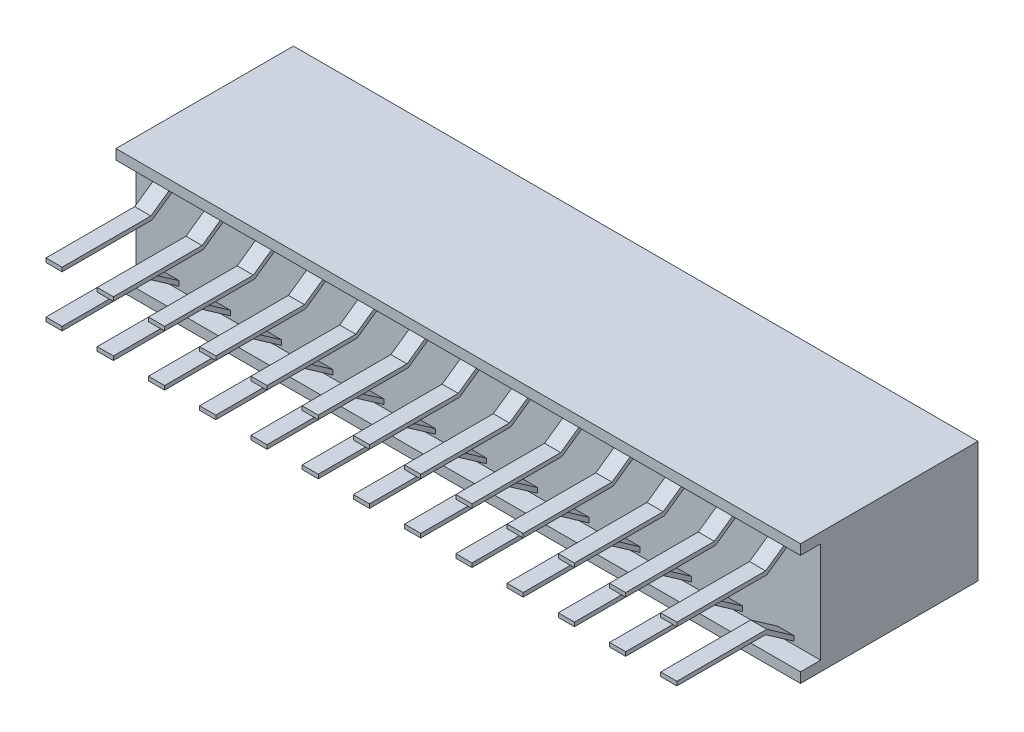
from build123d import *

# Parameters (mm, degrees)
SKETCH1_W                  = 16.97
SKETCH1_H                  = 3
BOSS_EXTRUDE1_DEPTH        = 4.4
SKETCH3_W                  = 0.45
SKETCH3_H                  = 0.45
CUT_EXTRUDE1_DEPTH         = 3
CHAMFER1_SIZE              = 0.1
SKETCH4_W                  = 0.5
SKETCH4_H                  = 2.5
CUT_EXTRUDE2_DEPTH         = 18.595195367
BOSS_EXTRUDE2_DEPTH        = 0.2
LPATTERN1_COUNT            = 13
LPATTERN1_PITCH            = 1.27
LPATTERN1_COPY_1_DEPTH     = 0.2
LPATTERN1_COPY_2_DEPTH     = 0.2
LPATTERN1_COPY_3_DEPTH     = 0.2
LPATTERN1_COPY_4_DEPTH     = 0.2
LPATTERN1_COPY_5_DEPTH     = 0.2
LPATTERN1_COPY_6_DEPTH     = 0.2
LPATTERN1_COPY_7_DEPTH     = 0.2
LPATTERN1_COPY_8_DEPTH     = 0.2
LPATTERN1_COPY_9_DEPTH     = 0.2
LPATTERN1_COPY_10_DEPTH    = 0.2
LPATTERN1_COPY_11_DEPTH    = 0.2
LPATTERN1_COPY_12_DEPTH    = 0.2
CHAMFER1_OF_LPATTERN1_SIZE = 0.1


with BuildPart() as part:
    # Sketch1 → Boss-Extrude1 (new body)
    with BuildSketch(Plane.XY):
        Rectangle(SKETCH1_W, SKETCH1_H)
    extrude(amount=BOSS_EXTRUDE1_DEPTH)

    # Sketch3 → Cut-Extrude1 (cut)
    with BuildSketch(Plane(origin=(0, 0, 0), x_dir=(-1, 0, 0), z_dir=(0, 0, -1))):
        with Locations((-7.62, 0.635)):
            Rectangle(SKETCH3_W, SKETCH3_H)
        with Locations((-7.62, -0.635)):
            Rectangle(SKETCH3_W, SKETCH3_H)
    cut_extrude1 = extrude(amount=-CUT_EXTRUDE1_DEPTH, mode=Mode.SUBTRACT)

    # Chamfer1
    chamfer1_edges = [part.edges().sort_by_distance(p)[0] for p in [
        (7.395, 0.635, 0),
        (7.62, 0.86, 0),
        (7.845, 0.635, 0),
        (7.62, 0.41, 0),
        (7.395, -0.635, 0),
        (7.62, -0.41, 0),
        (7.845, -0.635, 0),
        (7.62, -0.86, 0),
    ]]
    chamfer(chamfer1_edges, length=CHAMFER1_SIZE)

    # Sketch4 → Cut-Extrude2 (cut, through all)
    with BuildSketch(Plane(origin=(8.485, 0, 0), x_dir=(0, 0, -1), z_dir=(1, 0, 0))):
        with Locations((-4.15, 0)):
            Rectangle(SKETCH4_W, SKETCH4_H)
    extrude(amount=-CUT_EXTRUDE2_DEPTH, mode=Mode.SUBTRACT)

    # Sketch5 → Boss-Extrude2 (add, symmetric)
    with BuildSketch(Plane(origin=(7.62, 0, 0), x_dir=(0, 0, -1), z_dir=(1, 0, 0))):
        Polygon((-3.9, 1.175145277), (-4.6, 0.685), (-6.8, 0.685), (-6.8, 0.585), (-4.568470121, 0.585), (-3.9, 1.053067818), align=None)
    boss_extrude2 = extrude(amount=BOSS_EXTRUDE2_DEPTH, both=True)

    # Mirror1: Boss-Extrude2 across plane
    add(boss_extrude2.mirror(Plane.ZX))

    # LPattern1: Cut-Extrude1, Boss-Extrude2 ×13
    with Locations(*[(-i * LPATTERN1_PITCH, 0, 0) for i in range(1, LPATTERN1_COUNT)]):
        add(cut_extrude1, mode=Mode.SUBTRACT)
        add(boss_extrude2)

    # LPattern1 copy 1 sketch → LPattern1 copy 1 (add, symmetric)
    with BuildSketch(Plane(origin=(6.35, 0, 0), x_dir=(0, 0, -1), z_dir=(1, 0, 0))):
        Polygon((-3.9, -1.175145277), (-4.6, -0.685), (-6.8, -0.685), (-6.8, -0.585), (-4.568470121, -0.585), (-3.9, -1.053067818), align=None)
    extrude(amount=LPATTERN1_COPY_1_DEPTH, both=True)

    # LPattern1 copy 2 sketch → LPattern1 copy 2 (add, symmetric)
    with BuildSketch(Plane(origin=(5.08, 0, 0), x_dir=(0, 0, -1), z_dir=(1, 0, 0))):
        Polygon((-3.9, -1.175145277), (-4.6, -0.685), (-6.8, -0.685), (-6.8, -0.585), (-4.568470121, -0.585), (-3.9, -1.053067818), align=None)
    extrude(amount=LPATTERN1_COPY_2_DEPTH, both=True)

    # LPattern1 copy 3 sketch → LPattern1 copy 3 (add, symmetric)
    with BuildSketch(Plane(origin=(3.81, 0, 0), x_dir=(0, 0, -1), z_dir=(1, 0, 0))):
        Polygon((-3.9, -1.175145277), (-4.6, -0.685), (-6.8, -0.685), (-6.8, -0.585), (-4.568470121, -0.585), (-3.9, -1.053067818), align=None)
    extrude(amount=LPATTERN1_COPY_3_DEPTH, both=True)

    # LPattern1 copy 4 sketch → LPattern1 copy 4 (add, symmetric)
    with BuildSketch(Plane(origin=(2.54, 0, 0), x_dir=(0, 0, -1), z_dir=(1, 0, 0))):
        Polygon((-3.9, -1.175145277), (-4.6, -0.685), (-6.8, -0.685), (-6.8, -0.585), (-4.568470121, -0.585), (-3.9, -1.053067818), align=None)
    extrude(amount=LPATTERN1_COPY_4_DEPTH, both=True)

    # LPattern1 copy 5 sketch → LPattern1 copy 5 (add, symmetric)
    with BuildSketch(Plane(origin=(1.27, 0, 0), x_dir=(0, 0, -1), z_dir=(1, 0, 0))):
        Polygon((-3.9, -1.175145277), (-4.6, -0.685), (-6.8, -0.685), (-6.8, -0.585), (-4.568470121, -0.585), (-3.9, -1.053067818), align=None)
    extrude(amount=LPATTERN1_COPY_5_DEPTH, both=True)

    # LPattern1 copy 6 sketch → LPattern1 copy 6 (add, symmetric)
    with BuildSketch(Plane(origin=(0, 0, 0), x_dir=(0, 0, -1), z_dir=(1, 0, 0))):
        Polygon((-3.9, -1.175145277), (-4.6, -0.685), (-6.8, -0.685), (-6.8, -0.585), (-4.568470121, -0.585), (-3.9, -1.053067818), align=None)
    extrude(amount=LPATTERN1_COPY_6_DEPTH, both=True)

    # LPattern1 copy 7 sketch → LPattern1 copy 7 (add, symmetric)
    with BuildSketch(Plane(origin=(-1.27, 0, 0), x_dir=(0, 0, -1), z_dir=(1, 0, 0))):
        Polygon((-3.9, -1.175145277), (-4.6, -0.685), (-6.8, -0.685), (-6.8, -0.585), (-4.568470121, -0.585), (-3.9, -1.053067818), align=None)
    extrude(amount=LPATTERN1_COPY_7_DEPTH, both=True)

    # LPattern1 copy 8 sketch → LPattern1 copy 8 (add, symmetric)
    with BuildSketch(Plane(origin=(-2.54, 0, 0), x_dir=(0, 0, -1), z_dir=(1, 0, 0))):
        Polygon((-3.9, -1.175145277), (-4.6, -0.685), (-6.8, -0.685), (-6.8, -0.585), (-4.568470121, -0.585), (-3.9, -1.053067818), align=None)
    extrude(amount=LPATTERN1_COPY_8_DEPTH, both=True)

    # LPattern1 copy 9 sketch → LPattern1 copy 9 (add, symmetric)
    with BuildSketch(Plane(origin=(-3.81, 0, 0), x_dir=(0, 0, -1), z_dir=(1, 0, 0))):
        Polygon((-3.9, -1.175145277), (-4.6, -0.685), (-6.8, -0.685), (-6.8, -0.585), (-4.568470121, -0.585), (-3.9, -1.053067818), align=None)
    extrude(amount=LPATTERN1_COPY_9_DEPTH, both=True)

    # LPattern1 copy 10 sketch → LPattern1 copy 10 (add, symmetric)
    with BuildSketch(Plane(origin=(-5.08, 0, 0), x_dir=(0, 0, -1), z_dir=(1, 0, 0))):
        Polygon((-3.9, -1.175145277), (-4.6, -0.685), (-6.8, -0.685), (-6.8, -0.585), (-4.568470121, -0.585), (-3.9, -1.053067818), align=None)
    extrude(amount=LPATTERN1_COPY_10_DEPTH, both=True)

    # LPattern1 copy 11 sketch → LPattern1 copy 11 (add, symmetric)
    with BuildSketch(Plane(origin=(-6.35, 0, 0), x_dir=(0, 0, -1), z_dir=(1, 0, 0))):
        Polygon((-3.9, -1.175145277), (-4.6, -0.685), (-6.8, -0.685), (-6.8, -0.585), (-4.568470121, -0.585), (-3.9, -1.053067818), align=None)
    extrude(amount=LPATTERN1_COPY_11_DEPTH, both=True)

    # LPattern1 copy 12 sketch → LPattern1 copy 12 (add, symmetric)
    with BuildSketch(Plane(origin=(-7.62, 0, 0), x_dir=(0, 0, -1), z_dir=(1, 0, 0))):
        Polygon((-3.9, -1.175145277), (-4.6, -0.685), (-6.8, -0.685), (-6.8, -0.585), (-4.568470121, -0.585), (-3.9, -1.053067818), align=None)
    extrude(amount=LPATTERN1_COPY_12_DEPTH, both=True)

    # Chamfer1 of LPattern1
    chamfer1_of_lpattern1_edges = [part.edges().sort_by_distance(p)[0] for p in [
        (6.125, 0.635, 0),
        (6.35, 0.86, 0),
        (6.575, 0.635, 0),
        (6.35, 0.41, 0),
        (6.125, -0.635, 0),
        (6.35, -0.41, 0),
        (6.575, -0.635, 0),
        (6.35, -0.86, 0),
        (4.855, 0.635, 0),
        (5.08, 0.86, 0),
        (5.305, 0.635, 0),
        (5.08, 0.41, 0),
        (4.855, -0.635, 0),
        (5.08, -0.41, 0),
        (5.305, -0.635, 0),
        (5.08, -0.86, 0),
        (3.585, 0.635, 0),
        (3.81, 0.86, 0),
        (4.035, 0.635, 0),
        (3.81, 0.41, 0),
        (3.585, -0.635, 0),
        (3.81, -0.41, 0),
        (4.035, -0.635, 0),
        (3.81, -0.86, 0),
        (2.315, 0.635, 0),
        (2.54, 0.86, 0),
        (2.765, 0.635, 0),
        (2.54, 0.41, 0),
        (2.315, -0.635, 0),
        (2.54, -0.41, 0),
        (2.765, -0.635, 0),
        (2.54, -0.86, 0),
        (1.045, 0.635, 0),
        (1.27, 0.86, 0),
        (1.495, 0.635, 0),
        (1.27, 0.41, 0),
        (1.045, -0.635, 0),
        (1.27, -0.41, 0),
        (1.495, -0.635, 0),
        (1.27, -0.86, 0),
        (-0.225, 0.635, 0),
        (0, 0.86, 0),
        (0.225, 0.635, 0),
        (0, 0.41, 0),
        (-0.225, -0.635, 0),
        (0, -0.41, 0),
        (0.225, -0.635, 0),
        (0, -0.86, 0),
        (-1.495, 0.635, 0),
        (-1.27, 0.86, 0),
        (-1.045, 0.635, 0),
        (-1.27, 0.41, 0),
        (-1.495, -0.635, 0),
        (-1.27, -0.41, 0),
        (-1.045, -0.635, 0),
        (-1.27, -0.86, 0),
        (-2.765, 0.635, 0),
        (-2.54, 0.86, 0),
        (-2.315, 0.635, 0),
        (-2.54, 0.41, 0),
        (-2.765, -0.635, 0),
        (-2.54, -0.41, 0),
        (-2.315, -0.635, 0),
        (-2.54, -0.86, 0),
        (-4.035, 0.635, 0),
        (-3.81, 0.86, 0),
        (-3.585, 0.635, 0),
        (-3.81, 0.41, 0),
        (-4.035, -0.635, 0),
        (-3.81, -0.41, 0),
        (-3.585, -0.635, 0),
        (-3.81, -0.86, 0),
        (-5.305, 0.635, 0),
        (-5.08, 0.86, 0),
        (-4.855, 0.635, 0),
        (-5.08, 0.41, 0),
        (-5.305, -0.635, 0),
        (-5.08, -0.41, 0),
        (-4.855, -0.635, 0),
        (-5.08, -0.86, 0),
        (-6.575, 0.635, 0),
        (-6.35, 0.86, 0),
        (-6.125, 0.635, 0),
        (-6.35, 0.41, 0),
        (-6.575, -0.635, 0),
        (-6.35, -0.41, 0),
        (-6.125, -0.635, 0),
        (-6.35, -0.86, 0),
        (-7.845, 0.635, 0),
        (-7.62, 0.86, 0),
        (-7.395, 0.635, 0),
        (-7.62, 0.41, 0),
        (-7.845, -0.635, 0),
        (-7.62, -0.41, 0),
        (-7.395, -0.635, 0),
        (-7.62, -0.86, 0),
    ]]
    chamfer(chamfer1_of_lpattern1_edges, length=CHAMFER1_OF_LPATTERN1_SIZE)


solid = part.part
